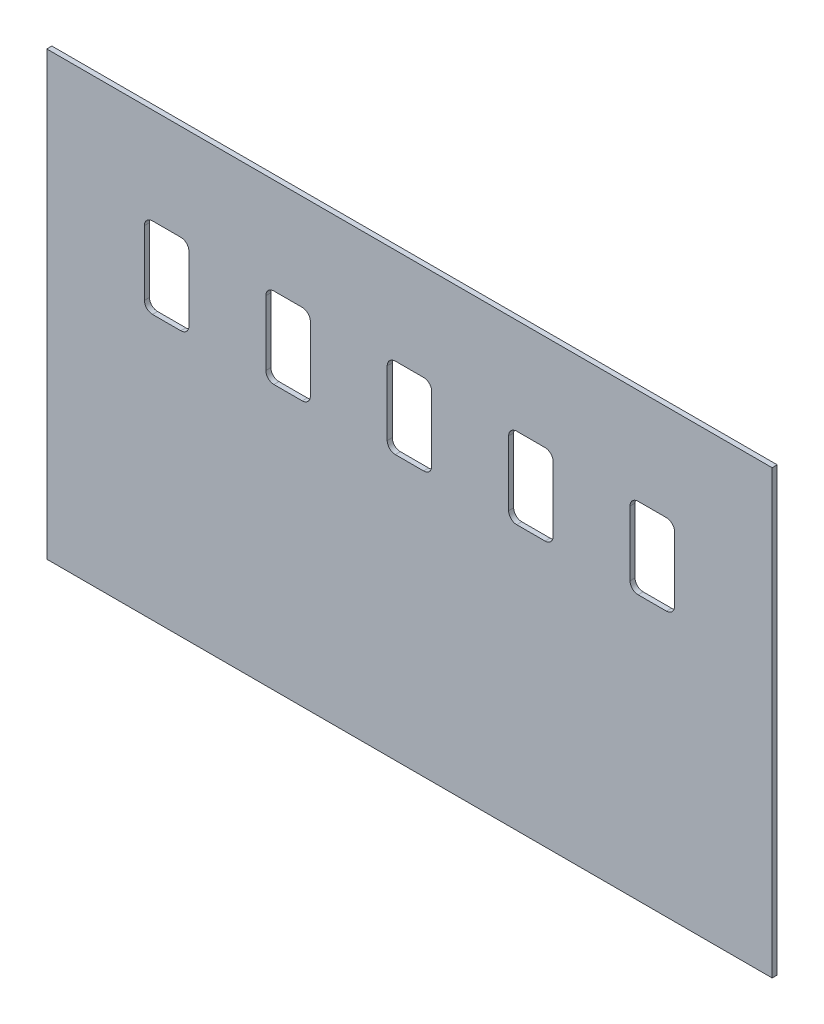
from build123d import *

# Parameters (mm, degrees)
SKETCH3_W           = 455.295
SKETCH3_H           = 277.368
BOSS_EXTRUDE1_DEPTH = 1.5875
CUT_EXTRUDE1_DEPTH  = 25.4


with BuildPart() as part:
    # Sketch3 → Boss-Extrude1 (new, symmetric)
    with BuildSketch(Plane.XY):
        Rectangle(SKETCH3_W, SKETCH3_H)
    extrude(amount=BOSS_EXTRUDE1_DEPTH, both=True)

    # Sketch4 → Cut-Extrude1 (cut)
    with BuildSketch(Plane.XY.offset(1.5875)):
        with BuildLine():
            Line((-161.29, 78.359001016), (-143.51, 78.359001016))
            ThreePointArc((-143.51, 78.359001016), (-139.917897552, 76.871103464), (-138.43, 73.279001016))
            Line((-138.43, 73.279001016), (-138.43, 32.639001016))
            ThreePointArc((-138.43, 32.639001016), (-139.917897552, 29.046898568), (-143.51, 27.559001016))
            Line((-143.51, 27.559001016), (-161.29, 27.559001016))
            ThreePointArc((-161.29, 27.559001016), (-164.882102448, 29.046898568), (-166.37, 32.639001016))
            Line((-166.37, 32.639001016), (-166.37, 73.279001016))
            ThreePointArc((-166.37, 73.279001016), (-164.882102448, 76.871103464), (-161.29, 78.359001016))
        make_face()
        with BuildLine():
            Line((-8.89, 78.359001016), (8.89, 78.359001016))
            ThreePointArc((8.89, 78.359001016), (12.482102448, 76.871103464), (13.97, 73.279001016))
            Line((13.97, 73.279001016), (13.97, 32.639001016))
            ThreePointArc((13.97, 32.639001016), (12.482102448, 29.046898568), (8.89, 27.559001016))
            Line((8.89, 27.559001016), (-8.89, 27.559001016))
            ThreePointArc((-8.89, 27.559001016), (-12.482102448, 29.046898568), (-13.97, 32.639001016))
            Line((-13.97, 32.639001016), (-13.97, 73.279001016))
            ThreePointArc((-13.97, 73.279001016), (-12.482102448, 76.871103464), (-8.89, 78.359001016))
        make_face()
        with BuildLine():
            Line((67.31, 78.359001016), (85.09, 78.359001016))
            ThreePointArc((85.09, 78.359001016), (88.682102448, 76.871103464), (90.17, 73.279001016))
            Line((90.17, 73.279001016), (90.17, 32.639001016))
            ThreePointArc((90.17, 32.639001016), (88.682102448, 29.046898568), (85.09, 27.559001016))
            Line((85.09, 27.559001016), (67.31, 27.559001016))
            ThreePointArc((67.31, 27.559001016), (63.717897552, 29.046898568), (62.23, 32.639001016))
            Line((62.23, 32.639001016), (62.23, 73.279001016))
            ThreePointArc((62.23, 73.279001016), (63.717897552, 76.871103464), (67.31, 78.359001016))
        make_face()
        with BuildLine():
            Line((143.51, 78.359001016), (161.29, 78.359001016))
            ThreePointArc((161.29, 78.359001016), (164.882102448, 76.871103464), (166.37, 73.279001016))
            Line((166.37, 73.279001016), (166.37, 32.639001016))
            ThreePointArc((166.37, 32.639001016), (164.882102448, 29.046898568), (161.29, 27.559001016))
            Line((161.29, 27.559001016), (143.51, 27.559001016))
            ThreePointArc((143.51, 27.559001016), (139.917897552, 29.046898568), (138.43, 32.639001016))
            Line((138.43, 32.639001016), (138.43, 73.279001016))
            ThreePointArc((138.43, 73.279001016), (139.917897552, 76.871103464), (143.51, 78.359001016))
        make_face()
        with BuildLine():
            Line((-85.09, 78.359001016), (-67.31, 78.359001016))
            ThreePointArc((-67.31, 78.359001016), (-63.717897552, 76.871103464), (-62.23, 73.279001016))
            Line((-62.23, 73.279001016), (-62.23, 32.639001016))
            ThreePointArc((-62.23, 32.639001016), (-63.717897552, 29.046898568), (-67.31, 27.559001016))
            Line((-67.31, 27.559001016), (-85.09, 27.559001016))
            ThreePointArc((-85.09, 27.559001016), (-88.682102448, 29.046898568), (-90.17, 32.639001016))
            Line((-90.17, 32.639001016), (-90.17, 73.279001016))
            ThreePointArc((-90.17, 73.279001016), (-88.682102448, 76.871103464), (-85.09, 78.359001016))
        make_face()
    extrude(amount=-CUT_EXTRUDE1_DEPTH, mode=Mode.SUBTRACT)


solid = part.part
